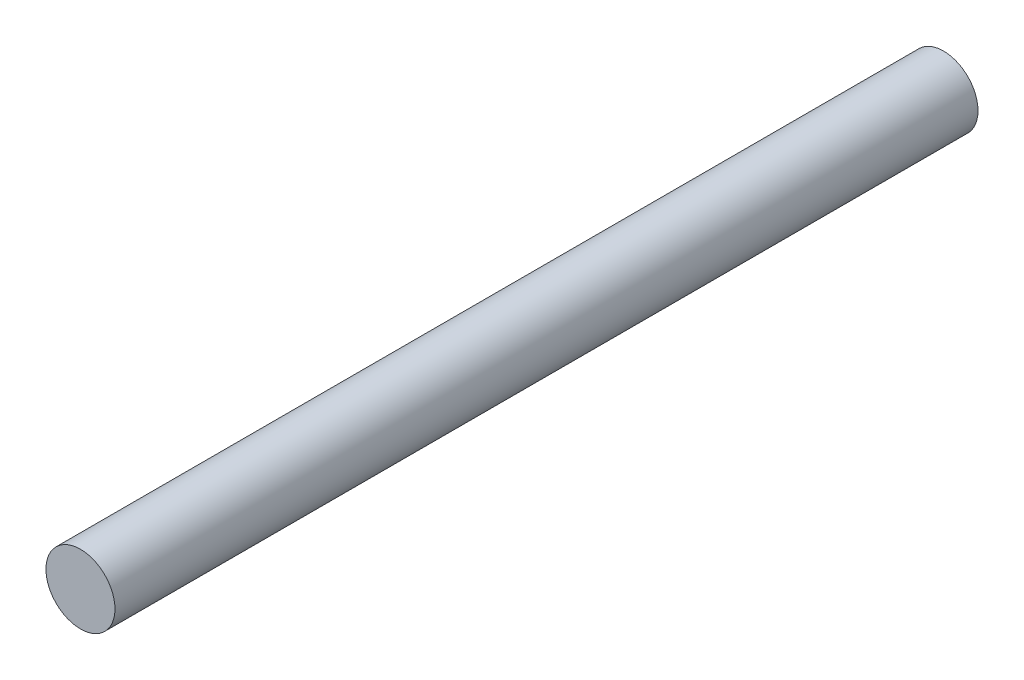
from build123d import *

# Parameters (mm, degrees)
CROQUIS1_R              = 7.5
SALIENTE_EXTRUIR1_DEPTH = 187.51


with BuildPart() as part:
    # Croquis1 → Saliente-Extruir1 (new body)
    with BuildSketch(Plane.XY):
        Circle(CROQUIS1_R)
    extrude(amount=SALIENTE_EXTRUIR1_DEPTH)


solid = part.part
